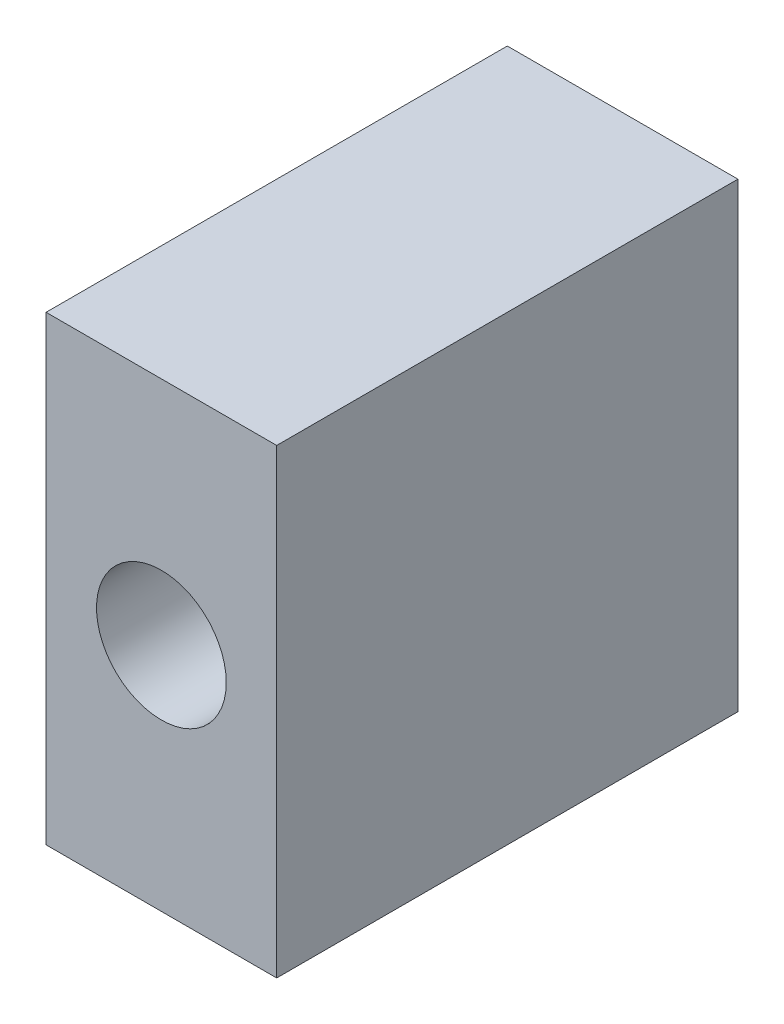
from build123d import *

# Parameters (mm, degrees)
SKETCH1_W           = 4
SKETCH1_H           = 8
SKETCH1_R           = 1.125
BOSS_EXTRUDE1_DEPTH = 8


with BuildPart() as part:
    # Sketch1 → Boss-Extrude1 (new body)
    with BuildSketch(Plane.XY):
        Rectangle(SKETCH1_W, SKETCH1_H)
        Circle(SKETCH1_R, mode=Mode.SUBTRACT)
    extrude(amount=BOSS_EXTRUDE1_DEPTH)


solid = part.part
